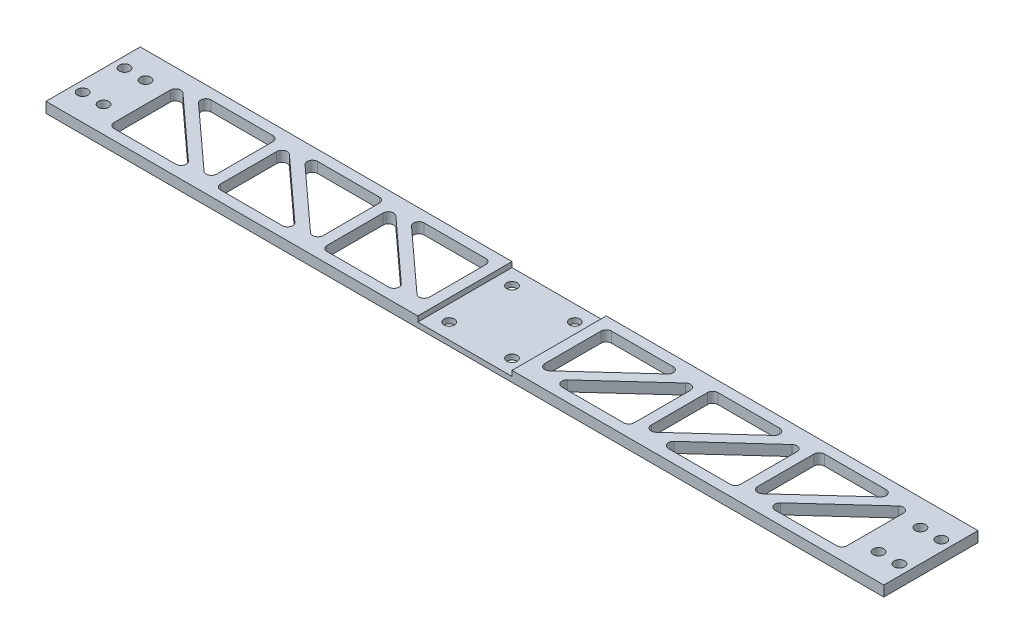
from build123d import *

# Parameters (mm, degrees)
SKETCH2_W                   = 57.15
SKETCH2_H                   = 6.35
BOSS_EXTRUDE2_DEPTH         = 254
F_1_4_0_25_DIAMETER_HOLE1_D = 6.35
CUT_EXTRUDE1_REACH          = 257.681
FILLET1_R                   = 3.175
FILLET1_OF_MIRROR4_R        = 3.175
SKETCH7_W                   = 57.15
SKETCH7_H                   = 57.15
CUT_EXTRUDE2_DEPTH          = 3.175
F_1_4_0_25_DIAMETER_HOLE2_D = 6.35


with BuildPart() as part:
    # Sketch2 → Boss-Extrude2 (new, symmetric)
    with BuildSketch(Plane(origin=(0, 0, 0), x_dir=(0, 0, -1), z_dir=(1, 0, 0))):
        Rectangle(SKETCH2_W, SKETCH2_H)
    extrude(amount=BOSS_EXTRUDE2_DEPTH, both=True)

    # 1/4 (0.25) Diameter Hole1 (through all)
    with Locations(Plane(origin=(0, 3.175, 0), x_dir=(1, 0, 0), z_dir=(0, 1, 0))):
        with Locations((-247.65, -12.7), (-247.65, 12.7), (-234.95, 12.7), (-234.95, -12.7)):
            f_1_4_0_25_diameter_hole1 = Hole(F_1_4_0_25_DIAMETER_HOLE1_D / 2)

    # Mirror1: 1/4 (0.25) Diameter Hole1 across plane
    add(f_1_4_0_25_diameter_hole1.mirror(Plane(origin=(0, 0, 0), x_dir=(0, 0, 1), z_dir=(1, 0, 0))), mode=Mode.SUBTRACT)

    # Sketch6 → Cut-Extrude1 (cut, up to next)
    with BuildSketch(Plane(origin=(0, 3.175, 0), x_dir=(1, 0, 0), z_dir=(0, 1, 0)), mode=Mode.PRIVATE) as cut_extrude1_sk1:
        Polygon((-222.25, 22.225), (-222.25, -22.225), (-173.469521198, -22.225), align=None)
    cut_extrude1_tool1 = extrude(cut_extrude1_sk1.sketch, amount=-CUT_EXTRUDE1_REACH, mode=Mode.PRIVATE) & part.part
    # Sketch6 → Cut-Extrude1 (cut, up to next)
    with BuildSketch(Plane(origin=(0, 3.175, 0), x_dir=(1, 0, 0), z_dir=(0, 1, 0)), mode=Mode.PRIVATE) as cut_extrude1_sk2:
        Polygon((-212.822145469, 22.225), (-164.041666667, -22.225), (-164.041666667, 22.225), align=None)
    cut_extrude1_tool2 = extrude(cut_extrude1_sk2.sketch, amount=-CUT_EXTRUDE1_REACH, mode=Mode.PRIVATE) & part.part
    # Sketch6 → Cut-Extrude1 (cut, up to next)
    with BuildSketch(Plane(origin=(0, 3.175, 0), x_dir=(1, 0, 0), z_dir=(0, 1, 0)), mode=Mode.PRIVATE) as cut_extrude1_sk3:
        Polygon((-157.691666667, 22.225), (-157.691666667, -22.225), (-108.911187865, -22.225), align=None)
    cut_extrude1_tool3 = extrude(cut_extrude1_sk3.sketch, amount=-CUT_EXTRUDE1_REACH, mode=Mode.PRIVATE) & part.part
    # Sketch6 → Cut-Extrude1 (cut, up to next)
    with BuildSketch(Plane(origin=(0, 3.175, 0), x_dir=(1, 0, 0), z_dir=(0, 1, 0)), mode=Mode.PRIVATE) as cut_extrude1_sk4:
        Polygon((-148.263812135, 22.225), (-99.483333333, -22.225), (-99.483333333, 22.225), align=None)
    cut_extrude1_tool4 = extrude(cut_extrude1_sk4.sketch, amount=-CUT_EXTRUDE1_REACH, mode=Mode.PRIVATE) & part.part
    # Sketch6 → Cut-Extrude1 (cut, up to next)
    with BuildSketch(Plane(origin=(0, 3.175, 0), x_dir=(1, 0, 0), z_dir=(0, 1, 0)), mode=Mode.PRIVATE) as cut_extrude1_sk5:
        Polygon((-93.133333333, 22.225), (-93.133333333, -22.225), (-44.352854531, -22.225), align=None)
    cut_extrude1_tool5 = extrude(cut_extrude1_sk5.sketch, amount=-CUT_EXTRUDE1_REACH, mode=Mode.PRIVATE) & part.part
    # Sketch6 → Cut-Extrude1 (cut, up to next)
    with BuildSketch(Plane(origin=(0, 3.175, 0), x_dir=(1, 0, 0), z_dir=(0, 1, 0)), mode=Mode.PRIVATE) as cut_extrude1_sk6:
        Polygon((-83.705478802, 22.225), (-34.925, -22.225), (-34.925, 22.225), align=None)
    cut_extrude1_tool6 = extrude(cut_extrude1_sk6.sketch, amount=-CUT_EXTRUDE1_REACH, mode=Mode.PRIVATE) & part.part
    cut_extrude1_1 = cut_extrude1_tool1.solids().sort_by_distance((-205.98984, 3.175, 7.408333))[0]
    add(cut_extrude1_1, mode=Mode.SUBTRACT)
    cut_extrude1_2 = cut_extrude1_tool2.solids().sort_by_distance((-180.301826, 3.175, -7.408333))[0]
    add(cut_extrude1_2, mode=Mode.SUBTRACT)
    cut_extrude1_3 = cut_extrude1_tool3.solids().sort_by_distance((-141.431507, 3.175, 7.408333))[0]
    add(cut_extrude1_3, mode=Mode.SUBTRACT)
    cut_extrude1_4 = cut_extrude1_tool4.solids().sort_by_distance((-115.743493, 3.175, -7.408333))[0]
    add(cut_extrude1_4, mode=Mode.SUBTRACT)
    cut_extrude1_5 = cut_extrude1_tool5.solids().sort_by_distance((-76.873174, 3.175, 7.408333))[0]
    add(cut_extrude1_5, mode=Mode.SUBTRACT)
    cut_extrude1_6 = cut_extrude1_tool6.solids().sort_by_distance((-51.18516, 3.175, -7.408333))[0]
    add(cut_extrude1_6, mode=Mode.SUBTRACT)
    cut_extrude1 = cut_extrude1_1 + cut_extrude1_2 + cut_extrude1_3 + cut_extrude1_4 + cut_extrude1_5 + cut_extrude1_6  # Cut-Extrude1 as one shape, for the pattern or mirror that repeats it

    # Fillet1
    fillet1_edges = [part.edges().sort_by_distance(p)[0] for p in [
        (-93.133333333, 0, -22.225),
        (-44.352854531, 0, 22.225),
        (-93.133333333, 0, 22.225),
        (-83.705478802, 0, -22.225),
        (-34.925, 0, -22.225),
        (-34.925, 0, 22.225),
        (-222.25, 0, -22.225),
        (-173.469521198, 0, 22.225),
        (-222.25, 0, 22.225),
        (-212.822145469, 0, -22.225),
        (-164.041666667, 0, -22.225),
        (-164.041666667, 0, 22.225),
        (-157.691666667, 0, -22.225),
        (-108.911187865, 0, 22.225),
        (-157.691666667, 0, 22.225),
        (-148.263812135, 0, -22.225),
        (-99.483333333, 0, -22.225),
        (-99.483333333, 0, 22.225),
    ]]
    fillet(fillet1_edges, radius=FILLET1_R)

    # Mirror4: Cut-Extrude1 across plane
    add(cut_extrude1.mirror(Plane(origin=(0, 0, 0), x_dir=(0, 0, 1), z_dir=(1, 0, 0))), mode=Mode.SUBTRACT)

    # Fillet1 of Mirror4
    fillet1_of_mirror4_edges = [part.edges().sort_by_distance(p)[0] for p in [
        (93.133333333, 0, -22.225),
        (44.352854531, 0, 22.225),
        (93.133333333, 0, 22.225),
        (83.705478802, 0, -22.225),
        (34.925, 0, -22.225),
        (34.925, 0, 22.225),
        (222.25, 0, -22.225),
        (173.469521198, 0, 22.225),
        (222.25, 0, 22.225),
        (212.822145469, 0, -22.225),
        (164.041666667, 0, -22.225),
        (164.041666667, 0, 22.225),
        (157.691666667, 0, -22.225),
        (108.911187865, 0, 22.225),
        (157.691666667, 0, 22.225),
        (148.263812135, 0, -22.225),
        (99.483333333, 0, -22.225),
        (99.483333333, 0, 22.225),
    ]]
    fillet(fillet1_of_mirror4_edges, radius=FILLET1_OF_MIRROR4_R)

    # Sketch7 → Cut-Extrude2 (cut)
    with BuildSketch(Plane(origin=(0, 3.175, 0), x_dir=(1, 0, 0), z_dir=(0, 1, 0))):
        Rectangle(SKETCH7_W, SKETCH7_H)
    extrude(amount=-CUT_EXTRUDE2_DEPTH, mode=Mode.SUBTRACT)

    # 1/4 (0.25) Diameter Hole2 (through all)
    with Locations(Plane(origin=(0, 0, 0), x_dir=(1, 0, 0), z_dir=(0, 1, 0))):
        with Locations((19.05, -19.05), (-19.05, 19.05), (-19.05, -19.05), (19.05, 19.05)):
            Hole(F_1_4_0_25_DIAMETER_HOLE2_D / 2)


solid = part.part
